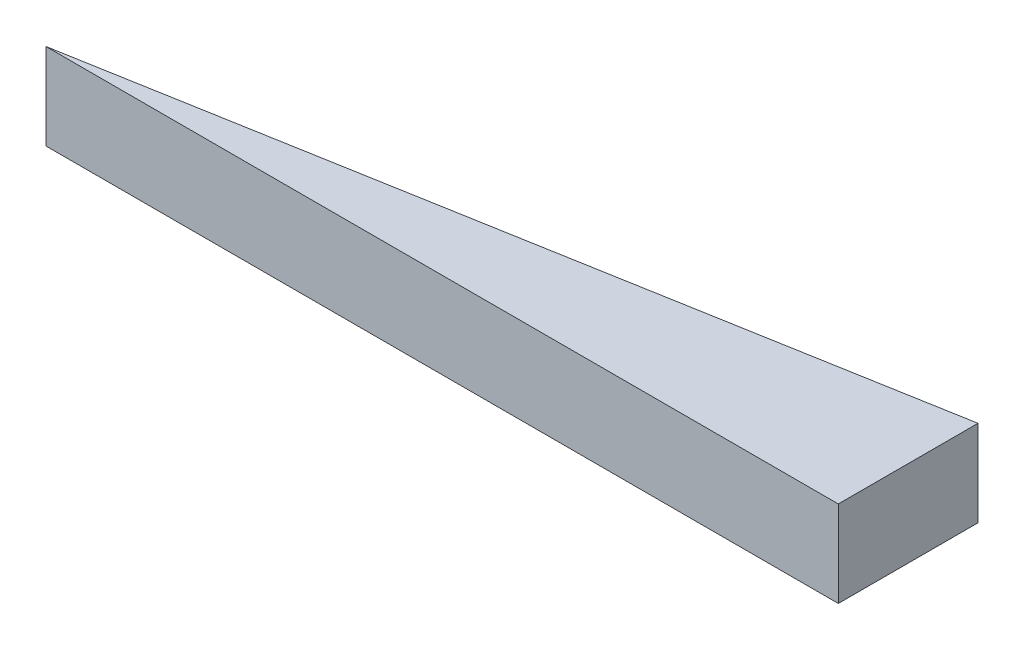
from build123d import *

# Parameters (mm, degrees)
BOSS_EXTRUDE1_DEPTH = 19.05


with BuildPart() as part:
    # Sketch1 → Boss-Extrude1 (new body)
    with BuildSketch(Plane(origin=(0, 0, 0), x_dir=(1, 0, 0), z_dir=(0, 1, 0))):
        Polygon((3.640955631, 0), (178.739774117, 0), (178.739774117, 30.874645989), align=None)
    extrude(amount=BOSS_EXTRUDE1_DEPTH)


solid = part.part
